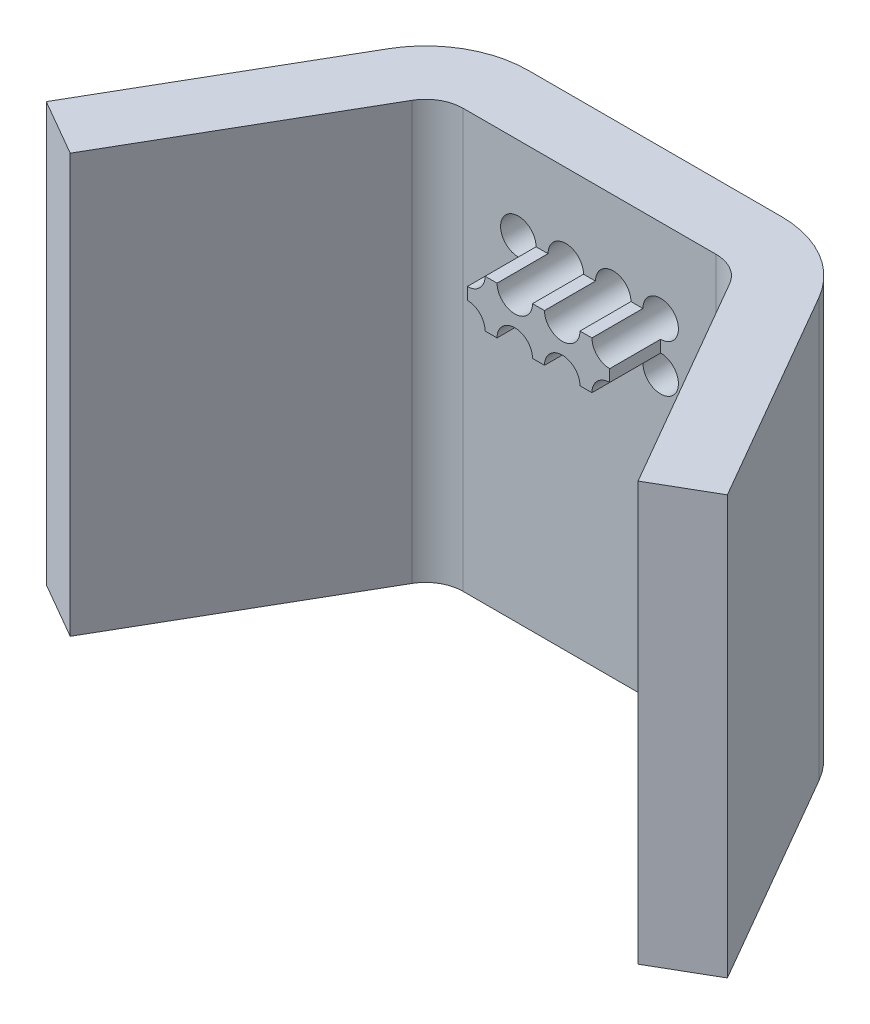
from build123d import *

# Parameters (mm, degrees)
BOSS_EXTRUDE1_DEPTH     = 22.4
FILLET1_R               = 2
FILLET2_R               = 5.5
BOSS_EXTRUDE2_DEPTH     = 2.73
CUT_EXTRUDE2_DEPTH      = 32.510198396
CUT_EXTRUDE2_DEPTH_BACK = 32.510198396
SKETCH3_R               = 0.95


with BuildPart() as part:
    # Sketch1 → Boss-Extrude1 (new body)
    with BuildSketch(Plane(origin=(0, 0, 0), x_dir=(1, 0, 0), z_dir=(0, 1, 0))):
        Polygon((-7.925386608, 7.925386608), (-15.2, -4.674613392), (-18.231088913, -2.924613392), (-9.94611255, 11.425386608), (9.94611255, 11.425386608), (18.231088913, -2.924613392), (15.2, -4.674613392), (7.925386608, 7.925386608), align=None)
    extrude(amount=BOSS_EXTRUDE1_DEPTH)

    # Fillet1
    fillet1_edges = [part.edges().sort_by_distance(p)[0] for p in [
        (7.925386608, 11.2, -7.925386608),
        (-7.925386608, 11.2, -7.925386608),
    ]]
    fillet(fillet1_edges, radius=FILLET1_R)

    # Fillet2
    fillet2_edges = [part.edges().sort_by_distance(p)[0] for p in [
        (-9.94611255, 11.2, -11.425386608),
        (9.94611255, 11.2, -11.425386608),
    ]]
    fillet(fillet2_edges, radius=FILLET2_R)

    # Sketch2 → Boss-Extrude2 (add)
    with BuildSketch(Plane.XY.offset(-7.925386608)):
        with BuildLine():
            Line((-0.32, 17.93), (0.32, 17.93))
            ThreePointArc((0.32, 17.93), (1.27, 16.98), (2.22, 17.93))
            Line((2.22, 17.93), (2.86, 17.93))
            ThreePointArc((2.86, 17.93), (3.138248558, 17.258248558), (3.81, 16.98))
            Line((3.81, 16.98), (3.81, 16.34))
            ThreePointArc((3.81, 16.34), (3.138248558, 16.061751442), (2.86, 15.39))
            Line((2.86, 15.39), (2.22, 15.39))
            ThreePointArc((2.22, 15.39), (1.27, 16.34), (0.32, 15.39))
            Line((0.32, 15.39), (-0.32, 15.39))
            ThreePointArc((-0.32, 15.39), (-1.27, 16.34), (-2.22, 15.39))
            Line((-2.22, 15.39), (-2.86, 15.39))
            ThreePointArc((-2.86, 15.39), (-3.138248558, 16.061751442), (-3.81, 16.34))
            Line((-3.81, 16.34), (-3.81, 16.98))
            ThreePointArc((-3.81, 16.98), (-3.138248558, 17.258248558), (-2.86, 17.93))
            Line((-2.86, 17.93), (-2.22, 17.93))
            ThreePointArc((-2.22, 17.93), (-1.27, 16.98), (-0.32, 17.93))
        make_face()
    extrude(amount=BOSS_EXTRUDE2_DEPTH)

    # Sketch3 → Cut-Extrude2 (cut, two sides: drawn at the far end of the back side and taken through both)
    with BuildSketch(Plane.XY.offset(-7.925386608).offset(-CUT_EXTRUDE2_DEPTH_BACK)):
        with Locations((-3.81, 17.93)):
            Circle(SKETCH3_R)
        with Locations((-1.27, 17.93)):
            Circle(SKETCH3_R)
        with Locations((1.27, 17.93)):
            Circle(SKETCH3_R)
        with Locations(Location((3.81, 17.93, 0), (0, 0, 180))):
            Circle(SKETCH3_R)
        with Locations(Location((3.81, 15.39, 0), (0, 0, 180))):
            Circle(SKETCH3_R)
        with Locations((1.27, 15.39)):
            Circle(SKETCH3_R)
        with Locations((-1.27, 15.39)):
            Circle(SKETCH3_R)
        with Locations((-3.81, 15.39)):
            Circle(SKETCH3_R)
    extrude(amount=CUT_EXTRUDE2_DEPTH + CUT_EXTRUDE2_DEPTH_BACK, mode=Mode.SUBTRACT)


solid = part.part
